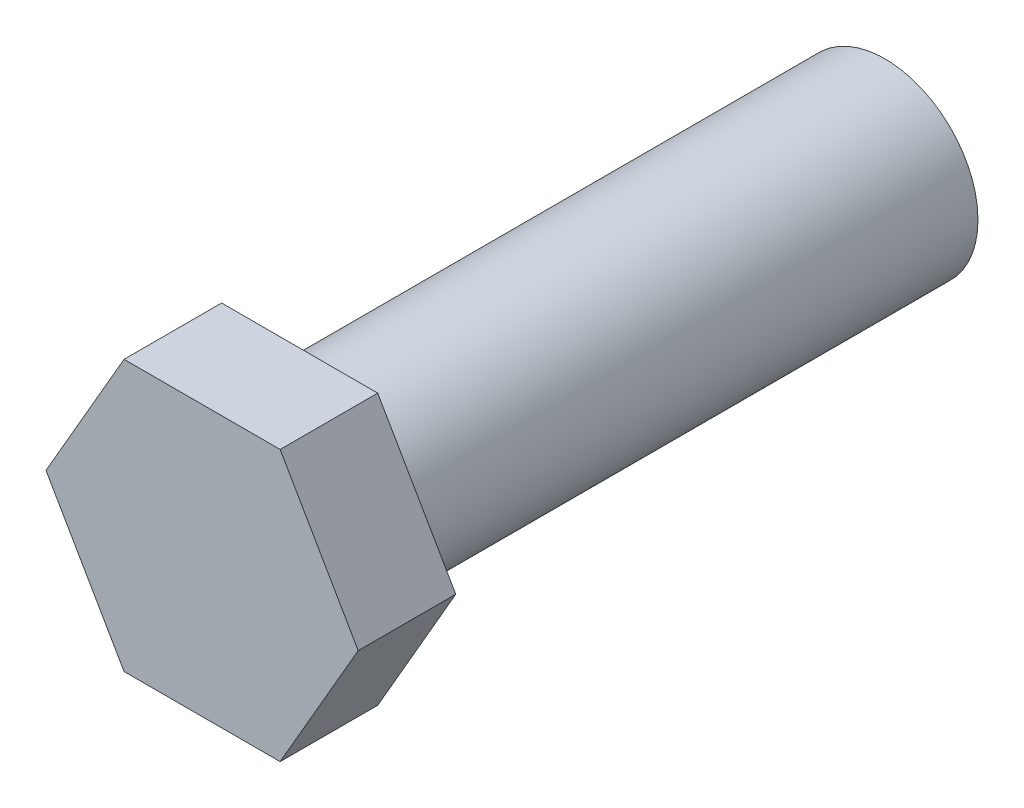
from build123d import *

# Parameters (mm, degrees)
RESSALTO_EXTRUS_O1_DEPTH = 5
ESBO_O2_R                = 4.765
RESSALTO_EXTRUS_O2_DEPTH = 30


with BuildPart() as part:
    # Esboço1 → Ressalto-extrusão1 (new body)
    with BuildSketch(Plane.XY):
        Polygon((8, 0), (4, 6.92820323), (-4, 6.92820323), (-8, 0), (-4, -6.92820323), (4, -6.92820323), align=None)
    extrude(amount=RESSALTO_EXTRUS_O1_DEPTH)

    # Esboço2 → Ressalto-extrusão2 (add)
    with BuildSketch(Plane(origin=(0, 0, 0), x_dir=(-1, 0, 0), z_dir=(0, 0, -1))):
        with Locations(Location((0, 0, 0), (0, 0, 180))):
            Circle(ESBO_O2_R)
    extrude(amount=RESSALTO_EXTRUS_O2_DEPTH)


solid = part.part
